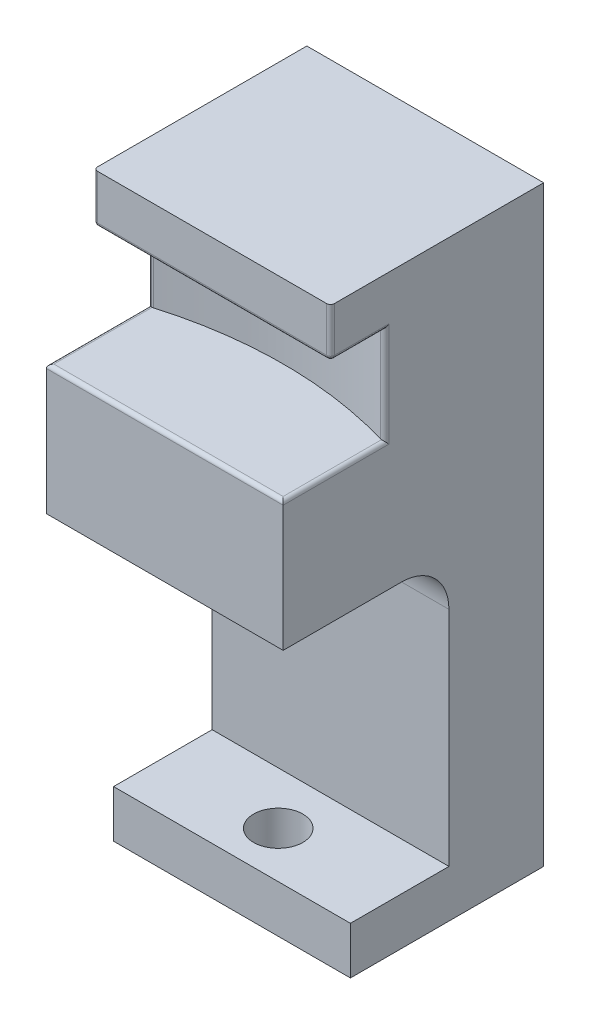
from build123d import *

# Parameters (mm, degrees)
SKETCH1_W           = 15.875
SKETCH1_H           = 34.925
BOSS_EXTRUDE1_DEPTH = 6.35
SKETCH3_W           = 15.875
SKETCH3_H           = 18.415
BOSS_EXTRUDE2_DEPTH = 7.9375
SKETCH4_R           = 26.9875
CUT_EXTRUDE2_DEPTH  = 3.2385
SKETCH5_W           = 15.875
SKETCH5_H           = 8.68045
BOSS_EXTRUDE3_DEPTH = 3.175
FILLET1_R           = 0.254
FILLET2_R           = 3.175
SKETCH6_W           = 15.875
SKETCH6_H           = 6.35
BOSS_EXTRUDE4_DEPTH = 4.7625
SKETCH7_W           = 15.875
SKETCH7_H           = 3.175
BOSS_EXTRUDE5_DEPTH = 6.604
CUT_EXTRUDE3_REACH  = 48.174
SKETCH8_R           = 1.651


with BuildPart() as part:
    # Sketch1 → Boss-Extrude1 (new body)
    with BuildSketch(Plane.XY):
        with Locations((7.9375, 17.4625)):
            Rectangle(SKETCH1_W, SKETCH1_H)
    extrude(amount=BOSS_EXTRUDE1_DEPTH)

    # Sketch3 → Boss-Extrude2 (add)
    with BuildSketch(Plane.XY.offset(6.35)):
        with Locations((7.9375, 25.7175)):
            Rectangle(SKETCH3_W, SKETCH3_H)
    extrude(amount=BOSS_EXTRUDE2_DEPTH)

    # Sketch4 → Cut-Extrude2 (cut, symmetric)
    with BuildSketch(Plane(origin=(0, 28.42895, 0), x_dir=(-1, 0, 0), z_dir=(0, -1, 0))):
        with Locations((-7.9375, -36.4998)):
            Circle(SKETCH4_R)
    extrude(amount=CUT_EXTRUDE2_DEPTH, both=True, mode=Mode.SUBTRACT)

    # Sketch5 → Boss-Extrude3 (add)
    with BuildSketch(Plane.XY.offset(14.2875)):
        with Locations((7.9375, 20.850225)):
            Rectangle(SKETCH5_W, SKETCH5_H)
    extrude(amount=BOSS_EXTRUDE3_DEPTH)

    # Fillet1
    fillet1_edges = [part.edges().sort_by_distance(p)[0] for p in [
        (0, 33.296225, 14.2875),
        (15.875, 33.296225, 14.2875),
        (7.9375, 31.66745, 14.2875),
        (15.875, 28.42895, 10.705978065),
        (0, 28.42895, 10.705978065),
        (0, 25.19045, 14.084239033),
        (15.875, 25.19045, 14.084239033),
        (0, 31.66745, 12.496739033),
        (15.875, 31.66745, 12.496739033),
        (7.9375, 25.19045, 17.4625),
    ]]
    fillet(fillet1_edges, radius=FILLET1_R)

    # Fillet2
    fillet2_edges = [part.edges().sort_by_distance(p)[0] for p in [
        (7.9375, 16.51, 6.35),
    ]]
    fillet(fillet2_edges, radius=FILLET2_R)

    # Sketch6 → Boss-Extrude4 (add)
    with BuildSketch(Plane.XZ):
        with Locations((7.9375, 3.175)):
            Rectangle(SKETCH6_W, SKETCH6_H)
    extrude(amount=BOSS_EXTRUDE4_DEPTH)

    # Sketch7 → Boss-Extrude5 (add)
    with BuildSketch(Plane.XY.offset(6.35)):
        with Locations((7.9375, -3.175)):
            Rectangle(SKETCH7_W, SKETCH7_H)
    extrude(amount=BOSS_EXTRUDE5_DEPTH)

    # Sketch8 → Cut-Extrude3 (cut, up to next)
    with BuildSketch(Plane.XZ.offset(4.7625), mode=Mode.PRIVATE) as cut_extrude3_sk1:
        with Locations(Location((7.9375, 9.8552, 0), (0, 0, 270))):
            Circle(SKETCH8_R)
    cut_extrude3_tool1 = extrude(cut_extrude3_sk1.sketch, amount=-CUT_EXTRUDE3_REACH, mode=Mode.PRIVATE) & part.part
    add(cut_extrude3_tool1.solids().sort_by_distance((7.9375, -4.7625, 9.8552))[0], mode=Mode.SUBTRACT)


solid = part.part
